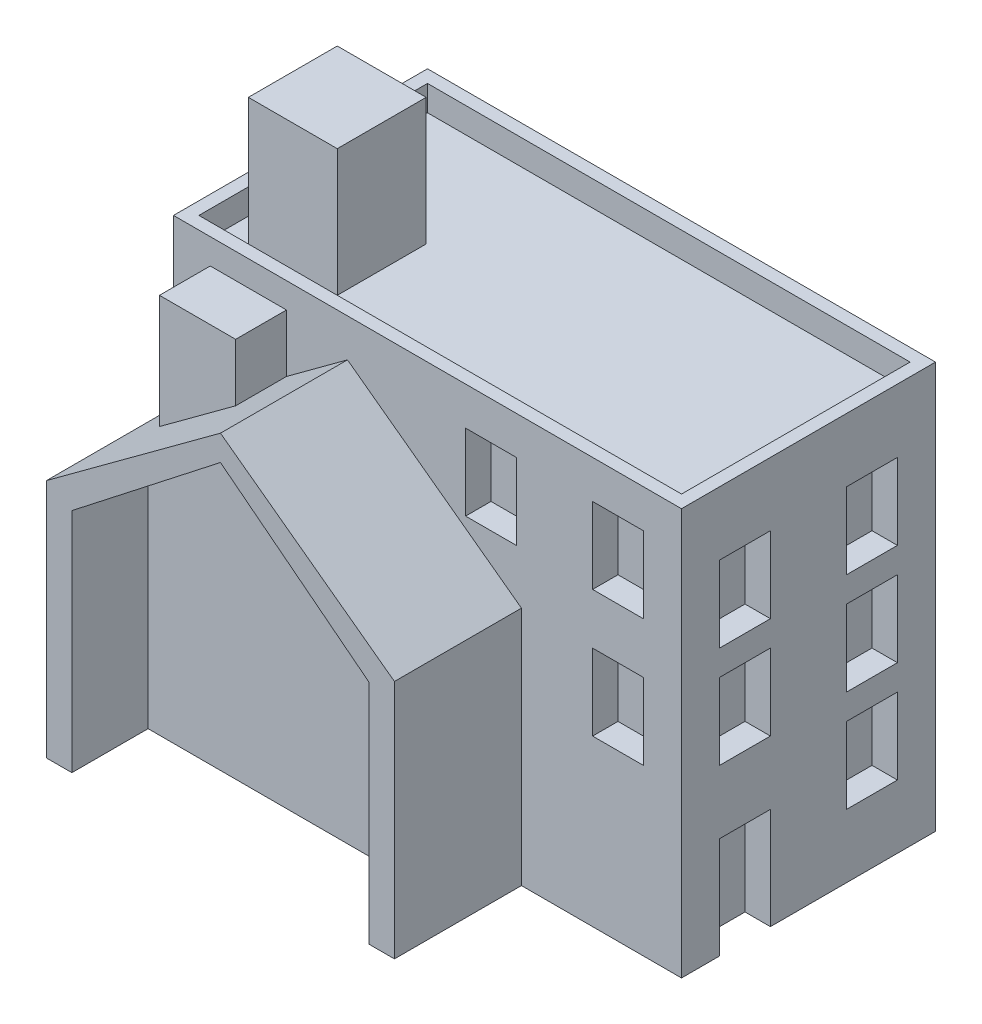
from build123d import *

# Parameters (mm, degrees)
CROQUIS1_W              = 20
CROQUIS1_H              = 10
SALIENTE_EXTRUIR1_DEPTH = 15
SALIENTE_EXTRUIR2_DEPTH = 5
SALIENTE_EXTRUIR3_DEPTH = 2
CROQUIS4_W              = 19
CROQUIS4_H              = 9
SALIENTE_EXTRUIR4_DEPTH = 1
CROQUIS4_3_W            = 3.5
CROQUIS4_3_H            = 3.5
SALIENTE_EXTRUIR5_DEPTH = 5
CROQUIS5_R              = 1.575
CORTAR_EXTRUIR1_DEPTH   = 2.5
CORTAR_EXTRUIR2_DEPTH   = 3
CROQUIS7_W              = 2
CROQUIS7_H              = 3
CORTAR_EXTRUIR3_DEPTH   = 1
CROQUIS8_W              = 2
CROQUIS8_H              = 4
CROQUIS8_H_2            = 3
CORTAR_EXTRUIR4_DEPTH   = 1
CROQUIS9_W              = 1.5
CROQUIS9_H              = 3
CORTAR_EXTRUIR5_DEPTH   = 1


with BuildPart() as part:
    # Croquis1 → Saliente-Extruir1 (new body)
    with BuildSketch(Plane(origin=(0, 0, 0), x_dir=(1, 0, 0), z_dir=(0, 1, 0))):
        Rectangle(CROQUIS1_W, CROQUIS1_H)
    extrude(amount=SALIENTE_EXTRUIR1_DEPTH)

    # Croquis2 → Saliente-Extruir2 (add)
    with BuildSketch(Plane.XY.offset(5)):
        Polygon((-10, 0), (3.69887005, 0), (3.69887005, 9.460087219), (-3.150564975, 14.5), (-10, 9.460087219), align=None)
    extrude(amount=SALIENTE_EXTRUIR2_DEPTH)

    # Croquis3 → Saliente-Extruir3 (add)
    with BuildSketch(Plane.XY.offset(5)):
        Polygon((-8.552244838, 10.525366285), (-8.552244838, 15), (-5.552244838, 15), (-5.552244838, 12.732809422), align=None)
    extrude(amount=SALIENTE_EXTRUIR3_DEPTH)

    # Croquis4 → Saliente-Extruir4 (add)
    with BuildSketch(Plane(origin=(0, 15, 0), x_dir=(1, 0, 0), z_dir=(0, 1, 0))):
        Polygon((-10, 4.5), (-10, -4.5), (-10, -5), (-9.5, -5), (-8.552244838, -5), (-5.552244838, -5), (9.5, -5), (10, -5), (10, -4.5), (10, 4.5), (10, 5), (9.5, 5), (-9.5, 5), (-10, 5), align=None)
        Rectangle(CROQUIS4_W, CROQUIS4_H, mode=Mode.SUBTRACT)
    extrude(amount=SALIENTE_EXTRUIR4_DEPTH)

    # Croquis4<3> → Saliente-Extruir5 (add)
    with BuildSketch(Plane(origin=(0, 15, 0), x_dir=(1, 0, 0), z_dir=(0, 1, 0))):
        with Locations((-6.802244838, -1.75)):
            Rectangle(CROQUIS4_3_W, CROQUIS4_3_H)
    extrude(amount=SALIENTE_EXTRUIR5_DEPTH)

    # Croquis5 → Cortar-Extruir1 (cut)
    with BuildSketch(Plane.XZ):
        Circle(CROQUIS5_R)
    extrude(amount=-CORTAR_EXTRUIR1_DEPTH, mode=Mode.SUBTRACT)

    # Croquis6 → Cortar-Extruir2 (cut)
    with BuildSketch(Plane.XY.offset(10)):
        Polygon((-9, 8.935724798), (-9, 0), (2.69887005, 0), (2.69887005, 8.933581491), (-3.150564975, 13.5), align=None)
    extrude(amount=-CORTAR_EXTRUIR2_DEPTH, mode=Mode.SUBTRACT)

    # Croquis7 → Cortar-Extruir3 (cut)
    with BuildSketch(Plane.XY.offset(5)):
        with Locations((2.5, 12.998129378)):
            Rectangle(CROQUIS7_W, CROQUIS7_H)
        with Locations((7.5, 12.998129378)):
            Rectangle(CROQUIS7_W, CROQUIS7_H)
        with Locations((7.5, 7.998129378)):
            Rectangle(CROQUIS7_W, CROQUIS7_H)
    extrude(amount=-CORTAR_EXTRUIR3_DEPTH, mode=Mode.SUBTRACT)

    # Croquis8 → Cortar-Extruir4 (cut)
    with BuildSketch(Plane.ZY.offset(10)):
        with Locations((2.5, 2)):
            Rectangle(CROQUIS8_W, CROQUIS8_H)
        with Locations((-2.5, 4)):
            Rectangle(CROQUIS8_W, CROQUIS8_H_2)
        with Locations((-2.5, 8)):
            Rectangle(CROQUIS8_W, CROQUIS8_H_2)
        with Locations((-2.5, 12)):
            Rectangle(CROQUIS8_W, CROQUIS8_H_2)
        with Locations((2.5, 12)):
            Rectangle(CROQUIS8_W, CROQUIS8_H_2)
        with Locations((2.5, 8)):
            Rectangle(CROQUIS8_W, CROQUIS8_H_2)
    cortar_extruir4 = extrude(amount=-CORTAR_EXTRUIR4_DEPTH, mode=Mode.SUBTRACT)

    # Croquis9 → Cortar-Extruir5 (cut)
    with BuildSketch(Plane(origin=(0, 0, -5), x_dir=(-1, 0, 0), z_dir=(0, 0, -1))):
        with Locations((-3.336666667, 4)):
            Rectangle(CROQUIS9_W, CROQUIS9_H)
        with Locations((-6.666666667, 4)):
            Rectangle(CROQUIS9_W, CROQUIS9_H)
        with Locations((-0.006666667, 4)):
            Rectangle(CROQUIS9_W, CROQUIS9_H)
        with Locations((3.323333333, 4)):
            Rectangle(CROQUIS9_W, CROQUIS9_H)
        with Locations((6.653333333, 4)):
            Rectangle(CROQUIS9_W, CROQUIS9_H)
        with Locations((-3.336666667, 8)):
            Rectangle(CROQUIS9_W, CROQUIS9_H)
        with Locations((-0.006666667, 8)):
            Rectangle(CROQUIS9_W, CROQUIS9_H)
        with Locations((3.323333333, 8)):
            Rectangle(CROQUIS9_W, CROQUIS9_H)
        with Locations((6.653333333, 8)):
            Rectangle(CROQUIS9_W, CROQUIS9_H)
        with Locations((-3.336666667, 12)):
            Rectangle(CROQUIS9_W, CROQUIS9_H)
        with Locations((-0.006666667, 12)):
            Rectangle(CROQUIS9_W, CROQUIS9_H)
        with Locations((3.323333333, 12)):
            Rectangle(CROQUIS9_W, CROQUIS9_H)
        with Locations((6.653333333, 12)):
            Rectangle(CROQUIS9_W, CROQUIS9_H)
        with Locations((-6.666666667, 8)):
            Rectangle(CROQUIS9_W, CROQUIS9_H)
        with Locations((-6.666666667, 12)):
            Rectangle(CROQUIS9_W, CROQUIS9_H)
    extrude(amount=-CORTAR_EXTRUIR5_DEPTH, mode=Mode.SUBTRACT)

    # Simetría1: Cortar-Extruir4 across plane
    add(cortar_extruir4.mirror(Plane(origin=(0, 0, 0), x_dir=(0, 0, 1), z_dir=(1, 0, 0))), mode=Mode.SUBTRACT)


solid = part.part
